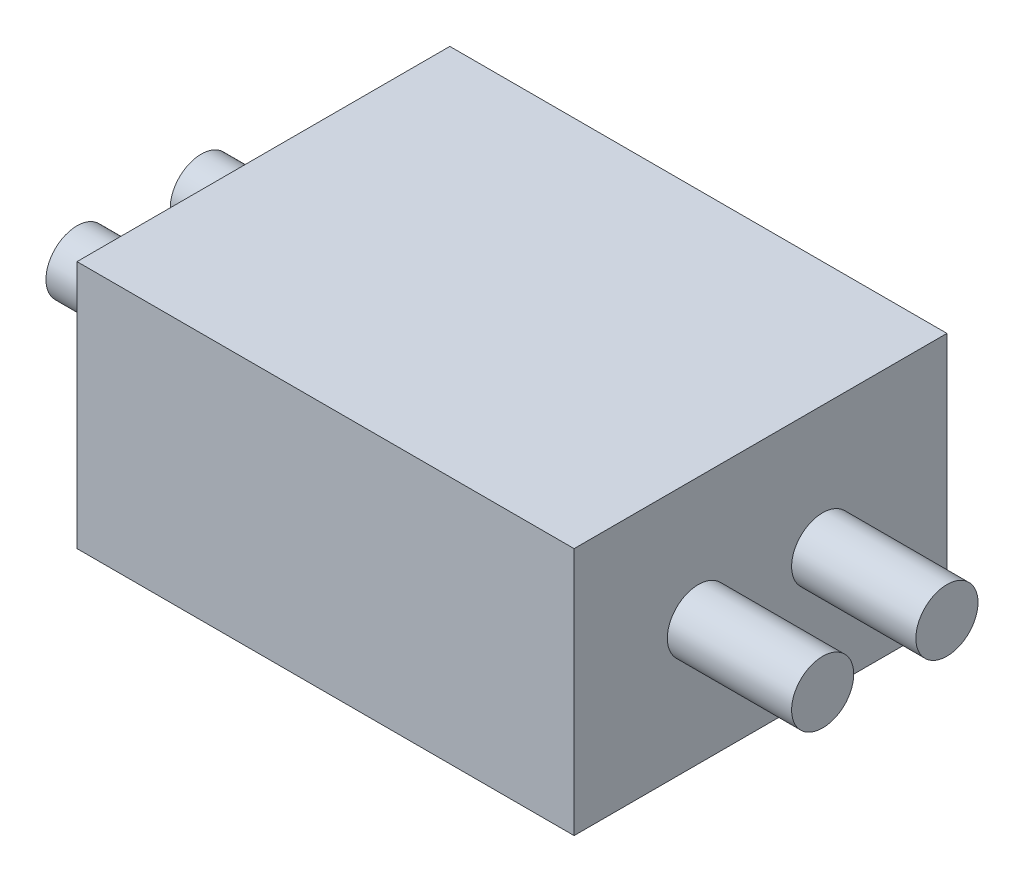
from build123d import *

# Parameters (mm, degrees)
SKETCH1_W           = 8
SKETCH1_H           = 6
BOSS_EXTRUDE1_DEPTH = 4
SKETCH2_R           = 0.5
BOSS_EXTRUDE2_DEPTH = 6


with BuildPart() as part:
    # Sketch1 → Boss-Extrude1 (new body)
    with BuildSketch(Plane(origin=(0, 0, 0), x_dir=(1, 0, 0), z_dir=(0, 1, 0))):
        Rectangle(SKETCH1_W, SKETCH1_H)
    extrude(amount=BOSS_EXTRUDE1_DEPTH)

    # Sketch2 → Boss-Extrude2 (add, symmetric)
    with BuildSketch(Plane(origin=(0, 0, 0), x_dir=(0, 0, -1), z_dir=(1, 0, 0))):
        with Locations((-1, 2)):
            Circle(SKETCH2_R)
        with Locations((1, 2)):
            Circle(SKETCH2_R)
    extrude(amount=BOSS_EXTRUDE2_DEPTH, both=True)


solid = part.part
